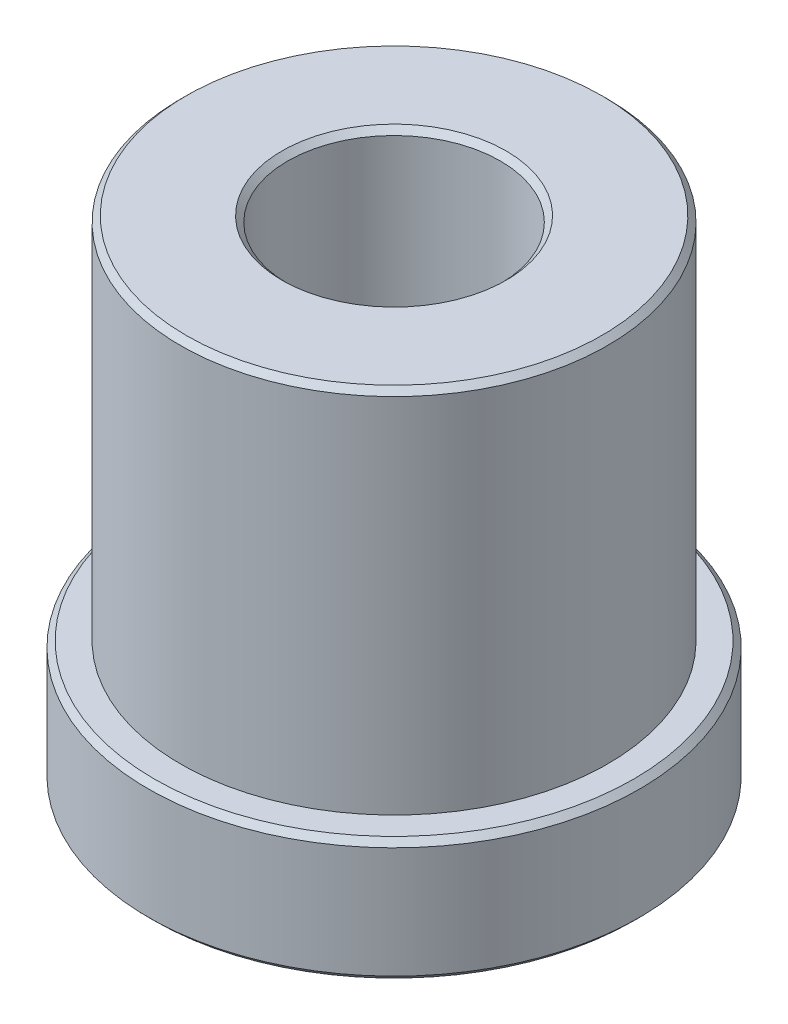
from build123d import *

# Parameters (mm, degrees)
SKETCH1_R           = 11.049
BOSS_EXTRUDE1_DEPTH = 19.05
SKETCH2_R           = 12.7
BOSS_EXTRUDE2_DEPTH = 6.35
SKETCH3_R           = 5.5
CUT_EXTRUDE1_DEPTH  = 32.108519733
SKETCH4_R           = 11.1125
CUT_EXTRUDE2_DEPTH  = 5.5372
CHAMFER1_SIZE       = 0.299999908


with BuildPart() as part:
    # Sketch1 → Boss-Extrude1 (new body)
    with BuildSketch(Plane(origin=(0, 0, 0), x_dir=(1, 0, 0), z_dir=(0, 1, 0))):
        with Locations(Location((0, 0, 0), (0, 0, 90))):
            Circle(SKETCH1_R)
    extrude(amount=BOSS_EXTRUDE1_DEPTH)

    # Sketch2 → Boss-Extrude2 (add)
    with BuildSketch(Plane.XZ):
        with Locations(Location((0, 0, 0), (0, 0, 270))):
            Circle(SKETCH2_R)
    extrude(amount=BOSS_EXTRUDE2_DEPTH)

    # Sketch3 → Cut-Extrude1 (cut, through all)
    with BuildSketch(Plane.XZ.offset(6.35)):
        with Locations(Location((0, 0, 0), (0, 0, 270))):
            Circle(SKETCH3_R)
    extrude(amount=-CUT_EXTRUDE1_DEPTH, mode=Mode.SUBTRACT)

    # Sketch4 → Cut-Extrude2 (cut)
    with BuildSketch(Plane.XZ.offset(6.35)):
        with Locations(Location((0, 0, 0), (0, 0, 270))):
            Circle(SKETCH4_R)
    extrude(amount=-CUT_EXTRUDE2_DEPTH, mode=Mode.SUBTRACT)

    # Chamfer1
    chamfer1_edges = [part.edges().sort_by_distance(p)[0] for p in [
        (0, 19.05, 5.5),
        (0, -6.35, 11.1125),
        (0, -0.8128, 5.5),
        (0, 19.05, 11.049),
        (0, 0, 12.7),
        (0, -6.35, 12.7),
    ]]
    chamfer(chamfer1_edges, length=CHAMFER1_SIZE)


solid = part.part
